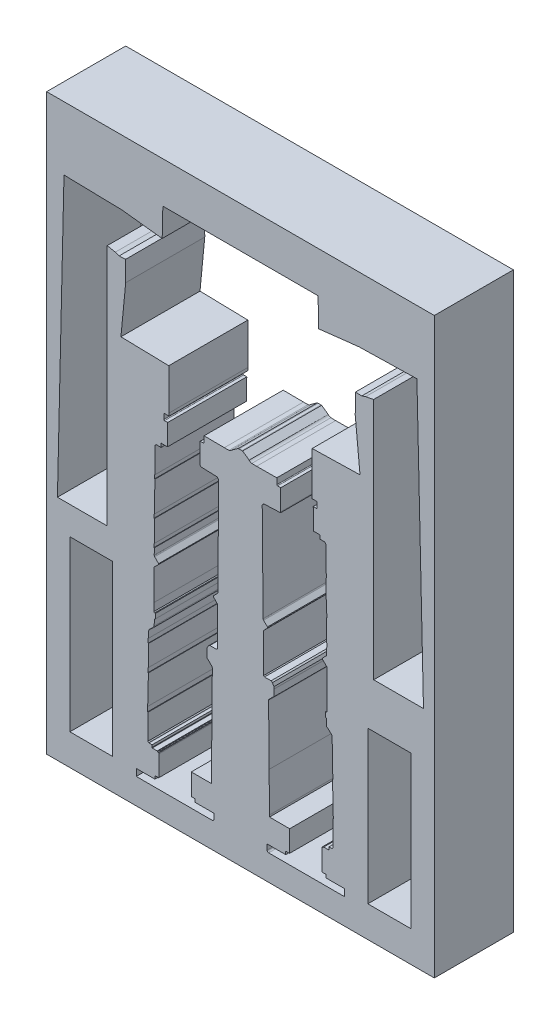
from build123d import *

# Parameters (mm, degrees)
SKETCH1_W           = 250
SKETCH1_H           = 370
BOSS_EXTRUDE1_DEPTH = 51
SKETCH2_W           = 27.335613065
SKETCH2_H           = 108.94321261
SKETCH2_W_2         = 27.852265483
SKETCH2_H_2         = 98.093511825
CUT_EXTRUDE1_DEPTH  = 285.123212709


with BuildPart() as part:
    # Sketch1 → Boss-Extrude1 (new body)
    with BuildSketch(Plane.XY):
        with Locations((0, -65)):
            Rectangle(SKETCH1_W, SKETCH1_H)
        with BuildLine():
            Line((-18.185021614, -233.531351709), (-67.185021808, -233.531351709))
            Line((-67.185021808, -233.531351709), (-67.185021808, -229.031351709))
            Line((-67.185021808, -229.031351709), (-55.173295176, -229.031351709))
            Line((-55.173295176, -229.031351709), (-55.173295176, -227.025013029))
            Line((-55.173295176, -227.025013029), (-52.683469695, -227.025013029))
            Line((-52.683469695, -227.025013029), (-52.685021808, -213.713725897))
            Line((-52.685021808, -213.713725897), (-52.635687886, -213.015646245))
            Line((-52.635687886, -213.015646245), (-53.046121529, -213.015646245))
            Line((-53.046121529, -213.015646245), (-53.442386914, -212.783926548))
            Line((-53.442386914, -212.783926548), (-53.690969911, -212.510759245))
            Line((-53.690969911, -212.510759245), (-56.723904041, -212.494295647))
            Line((-56.723904041, -212.494295647), (-56.956772754, -212.494295647))
            Line((-56.956772754, -212.494295647), (-57.027388135, -212.278767542))
            Line((-57.027388135, -212.278767542), (-57.021200289, -212.191616046))
            Line((-57.021200289, -212.191616046), (-57.008306081, -210.75455377))
            Line((-57.008306081, -210.75455377), (-58.883159083, -210.753940442))
            Line((-58.883159083, -210.753940442), (-59.106546484, -210.706908692))
            Line((-59.106546484, -210.706908692), (-59.678224018, -210.101533972))
            Line((-59.678224018, -210.101533972), (-59.556340753, -193.907794869))
            Line((-59.556340753, -193.907794869), (-59.554955617, -193.753421158))
            Line((-59.554955617, -193.753421158), (-59.854943541, -193.750729482))
            Line((-59.854943541, -193.750729482), (-59.828111994, -190.760347687))
            Line((-59.828111994, -190.760347687), (-59.357762351, -171.776188727))
            Line((-59.357762351, -171.776188727), (-59.657750275, -171.773497051))
            Line((-59.657750275, -171.773497051), (-59.630918728, -168.783115256))
            Line((-59.630918728, -168.783115256), (-59.330930803, -168.785806933))
            Line((-59.330930803, -168.785806933), (-59.209300032, -155.230358554))
            Line((-59.209300032, -155.230358554), (-59.509855326, -155.290572728))
            Line((-59.509855326, -155.290572728), (-59.483023778, -152.300190933))
            Line((-59.483023778, -152.300190933), (-59.183055092, -152.304175917))
            Line((-59.183055092, -152.304175917), (-59.14426295, -147.986426729))
            ThreePointArc((-59.14426295, -147.986426729), (-59.06598535, -147.603401722), (-58.849519734, -147.277858829))
            Line((-58.849519734, -147.277858829), (-56.207336343, -144.671249947))
            ThreePointArc((-56.207336343, -144.671249947), (-55.93294031, -144.472614758), (-55.611659616, -144.365246994))
            Line((-55.611659616, -144.365246994), (-55.605728481, -143.704220728))
            Line((-55.605728481, -143.704220728), (-55.573192383, -140.080460338))
            ThreePointArc((-55.573192383, -140.080460338), (-55.364538546, -139.582349279), (-54.866849153, -139.372691655))
            Line((-54.866849153, -139.372691655), (-54.866849153, -136.323642366))
            Line((-54.866849153, -136.323642366), (-55.389440509, -136.318953354))
            Line((-55.389440509, -136.318953354), (-55.884964754, -135.814457936))
            Line((-55.884964754, -135.814457936), (-55.839789757, -130.772915055))
            Line((-55.839789757, -130.772915055), (-55.660658646, -110.815493364))
            Line((-55.660658646, -110.815493364), (-52.781709227, -107.987743))
            Line((-52.781709227, -107.987743), (-52.781709227, -107.484907855))
            Line((-52.781709227, -107.484907855), (-55.318252521, -104.907581222))
            ThreePointArc((-55.318252521, -104.907581222), (-55.530620104, -104.582967818), (-55.601271237, -104.201546437))
            Line((-55.601271237, -104.201546437), (-55.564115337, -100.059928078))
            Line((-55.564115337, -100.059928078), (-55.864194832, -100.063234391))
            Line((-55.864194832, -100.063234391), (-55.841764195, -97.56333502))
            Line((-55.841764195, -97.56333502), (-55.54177627, -97.566026696))
            Line((-55.54177627, -97.566026696), (-55.416164704, -83.566590217))
            Line((-55.416164704, -83.566590217), (-55.716152628, -83.56389854))
            Line((-55.716152628, -83.56389854), (-55.693721991, -81.063999169))
            Line((-55.693721991, -81.063999169), (-55.393734067, -81.066690846))
            Line((-55.393734067, -81.066690846), (-55.218775098, -61.56747575))
            Line((-55.218775098, -61.56747575), (-55.518763023, -61.564784073))
            Line((-55.518763023, -61.564784073), (-55.496332386, -59.064884702))
            Line((-55.496332386, -59.064884702), (-55.196344461, -59.067576378))
            Line((-55.196344461, -59.067576378), (-55.048969005, -42.642549665))
            ThreePointArc((-55.048969005, -42.642549665), (-55.025101143, -42.527948071), (-54.959191853, -42.43120529))
            Line((-54.959191853, -42.43120529), (-54.279717387, -41.763874475))
            Line((-54.279717387, -41.763874475), (-51.203665072, -41.835346608))
            Line((-51.203665072, -41.835346608), (-51.203665072, -39.38923516))
            Line((-51.203665072, -39.38923516), (-47.045907397, -39.38923516))
            Line((-47.045907397, -39.38923516), (-46.936772239, -25.721501587))
            Line((-46.936772239, -25.721501587), (-48.948683759, -25.721501587))
            ThreePointArc((-48.948683759, -25.721501587), (-49.30223715, -25.575054978), (-49.44868376, -25.221501587))
            Line((-49.44868376, -25.221501587), (-49.448683759, -22.221501587))
            ThreePointArc((-49.448683759, -22.221501587), (-49.30223715, -21.867948197), (-48.94868376, -21.721501587))
            Line((-48.94868376, -21.721501587), (-46.01210545, -21.721501587))
            Line((-46.01210545, -21.721501587), (-45.998168892, -19.921501587))
            Line((-45.998168892, -19.921501587), (-46.233783896, 6.337841933))
            Line((-46.233783896, 6.337841933), (-77.088207762, 7.054745049))
            Line((-77.088207762, 7.054745049), (-74.016505234, 38.807848848))
            Line((-74.016505234, 38.807848848), (-74.120502381, 51.785705827))
            Line((-74.120502381, 51.785705827), (-78.220506343, 51.666031674))
            Line((-78.220506343, 51.666031674), (-80.720506343, 52.506819007))
            Line((-80.720506343, 52.506819007), (-85.910513182, 53.567167336))
            Line((-85.910513182, 53.567167336), (-85.910513182, -103.004374638))
            Line((-85.910513182, -103.004374638), (-118.027325005, -103.004374638))
            Line((-118.027325005, -103.004374638), (-113.796847451, 79.068969216))
            Line((-113.796847451, 79.068969216), (-78.220506343, 78.254616739))
            Line((-78.220506343, 78.254616739), (-76.720506343, 78.254616739))
            Line((-76.720506343, 78.254616739), (-50.470506343, 75.261840244))
            Line((-50.470506343, 75.261840244), (-50.05201383, 93.544381064))
            Line((-50.05201383, 93.544381064), (50.05201383, 93.544381064))
            Line((50.05201383, 93.544381064), (50.470506343, 75.261840244))
            Line((50.470506343, 75.261840244), (76.720506343, 78.254616739))
            Line((76.720506343, 78.254616739), (78.220506343, 78.254616739))
            Line((78.220506343, 78.254616739), (113.796847451, 79.068969216))
            Line((113.796847451, 79.068969216), (118.027325005, -103.004374638))
            Line((118.027325005, -103.004374638), (85.910513182, -103.004374638))
            Line((85.910513182, -103.004374638), (85.910513182, 53.567167336))
            Line((85.910513182, 53.567167336), (80.720506343, 52.506819007))
            Line((80.720506343, 52.506819007), (78.220506343, 51.666031674))
            Line((78.220506343, 51.666031674), (74.120502381, 51.785705827))
            Line((74.120502381, 51.785705827), (74.016505234, 38.807848848))
            Line((74.016505234, 38.807848848), (77.088207762, 7.054745049))
            Line((77.088207762, 7.054745049), (46.233783896, 6.337841933))
            Line((46.233783896, 6.337841933), (45.998168892, -19.921501587))
            Line((45.998168892, -19.921501587), (46.01210545, -21.721501587))
            Line((46.01210545, -21.721501587), (48.94868376, -21.721501587))
            ThreePointArc((48.94868376, -21.721501587), (49.30223715, -21.867948197), (49.448683759, -22.221501587))
            Line((49.448683759, -22.221501587), (49.44868376, -25.221501587))
            ThreePointArc((49.44868376, -25.221501587), (49.30223715, -25.575054978), (48.948683759, -25.721501587))
            Line((48.948683759, -25.721501587), (46.936772239, -25.721501587))
            Line((46.936772239, -25.721501587), (47.045907397, -39.38923516))
            Line((47.045907397, -39.38923516), (51.203665072, -39.38923516))
            Line((51.203665072, -39.38923516), (51.203665072, -41.835346608))
            Line((51.203665072, -41.835346608), (54.279717387, -41.763874475))
            Line((54.279717387, -41.763874475), (54.959191853, -42.43120529))
            ThreePointArc((54.959191853, -42.43120529), (55.025101143, -42.527948071), (55.048969005, -42.642549665))
            Line((55.048969005, -42.642549665), (55.196344461, -59.067576378))
            Line((55.196344461, -59.067576378), (55.496332386, -59.064884702))
            Line((55.496332386, -59.064884702), (55.518763023, -61.564784073))
            Line((55.518763023, -61.564784073), (55.218775098, -61.56747575))
            Line((55.218775098, -61.56747575), (55.393734067, -81.066690846))
            Line((55.393734067, -81.066690846), (55.693721991, -81.063999169))
            Line((55.693721991, -81.063999169), (55.716152628, -83.56389854))
            Line((55.716152628, -83.56389854), (55.416164704, -83.566590217))
            Line((55.416164704, -83.566590217), (55.54177627, -97.566026696))
            Line((55.54177627, -97.566026696), (55.841764195, -97.56333502))
            Line((55.841764195, -97.56333502), (55.864194832, -100.063234391))
            Line((55.864194832, -100.063234391), (55.564115337, -100.059928078))
            Line((55.564115337, -100.059928078), (55.601271237, -104.201546437))
            ThreePointArc((55.601271237, -104.201546437), (55.530620104, -104.582967818), (55.318252521, -104.907581222))
            Line((55.318252521, -104.907581222), (52.781709227, -107.484907855))
            Line((52.781709227, -107.484907855), (52.781709227, -107.987743))
            Line((52.781709227, -107.987743), (55.660658646, -110.815493364))
            Line((55.660658646, -110.815493364), (55.839789757, -130.772915055))
            Line((55.839789757, -130.772915055), (55.884964754, -135.814457936))
            Line((55.884964754, -135.814457936), (55.389440509, -136.318953354))
            Line((55.389440509, -136.318953354), (54.866849153, -136.323642366))
            Line((54.866849153, -136.323642366), (54.866849153, -139.372691655))
            ThreePointArc((54.866849153, -139.372691655), (55.364538546, -139.582349279), (55.573192383, -140.080460338))
            Line((55.573192383, -140.080460338), (55.605728481, -143.704220728))
            Line((55.605728481, -143.704220728), (55.611659616, -144.365246994))
            ThreePointArc((55.611659616, -144.365246994), (55.93294031, -144.472614758), (56.207336343, -144.671249947))
            Line((56.207336343, -144.671249947), (58.849519734, -147.277858829))
            ThreePointArc((58.849519734, -147.277858829), (59.06598535, -147.603401722), (59.14426295, -147.986426729))
            Line((59.14426295, -147.986426729), (59.183055092, -152.304175917))
            Line((59.183055092, -152.304175917), (59.483023778, -152.300190933))
            Line((59.483023778, -152.300190933), (59.509855326, -155.290572728))
            Line((59.509855326, -155.290572728), (59.209300032, -155.230358554))
            Line((59.209300032, -155.230358554), (59.330930803, -168.785806933))
            Line((59.330930803, -168.785806933), (59.630918728, -168.783115256))
            Line((59.630918728, -168.783115256), (59.657750275, -171.773497051))
            Line((59.657750275, -171.773497051), (59.357762351, -171.776188727))
            Line((59.357762351, -171.776188727), (59.828111994, -190.760347687))
            Line((59.828111994, -190.760347687), (59.854943541, -193.750729482))
            Line((59.854943541, -193.750729482), (59.554955617, -193.753421158))
            Line((59.554955617, -193.753421158), (59.556340753, -193.907794869))
            Line((59.556340753, -193.907794869), (59.678224018, -210.101533972))
            Line((59.678224018, -210.101533972), (59.106546484, -210.706908692))
            Line((59.106546484, -210.706908692), (58.883159083, -210.753940442))
            Line((58.883159083, -210.753940442), (57.008306081, -210.75455377))
            Line((57.008306081, -210.75455377), (57.021200289, -212.191616046))
            Line((57.021200289, -212.191616046), (57.027388135, -212.278767542))
            Line((57.027388135, -212.278767542), (56.956772754, -212.494295647))
            Line((56.956772754, -212.494295647), (56.723904041, -212.494295647))
            Line((56.723904041, -212.494295647), (53.690969911, -212.510759245))
            Line((53.690969911, -212.510759245), (53.442386914, -212.783926548))
            Line((53.442386914, -212.783926548), (53.046121529, -213.015646245))
            Line((53.046121529, -213.015646245), (52.635687886, -213.015646245))
            Line((52.635687886, -213.015646245), (52.685021808, -213.713725897))
            Line((52.685021808, -213.713725897), (52.683469695, -227.025013029))
            Line((52.683469695, -227.025013029), (55.173295176, -227.025013029))
            Line((55.173295176, -227.025013029), (55.173295176, -229.031351709))
            Line((55.173295176, -229.031351709), (67.185021808, -229.031351709))
            Line((67.185021808, -229.031351709), (67.185021808, -233.531351709))
            Line((67.185021808, -233.531351709), (18.185021614, -233.531351709))
            ThreePointArc((18.185021614, -233.531351709), (17.477914901, -233.238458478), (17.185021808, -232.531351709))
            Line((17.185021808, -232.531351709), (17.185021808, -229.031351709))
            Line((17.185021808, -229.031351709), (29.185021808, -229.031351709))
            Line((29.185021808, -229.031351709), (29.185021808, -227.531351709))
            ThreePointArc((29.185021808, -227.531351709), (29.331468418, -227.177798318), (29.685021808, -227.031351709))
            Line((29.685021808, -227.031351709), (31.696933329, -227.031351709))
            Line((31.696933329, -227.031351709), (31.728920327, -213.267440099))
            Line((31.728920327, -213.267440099), (27.406582755, -213.267440099))
            Line((27.406582755, -213.267440099), (18.717794744, -213.267440099))
            Line((18.717794744, -213.267440099), (18.717794744, -212.084118939))
            Line((18.717794744, -212.084118939), (18.490494489, -186.753149347))
            Line((18.490494489, -186.753149347), (18.146119113, -148.3676652))
            ThreePointArc((18.146119113, -148.3676652), (18.218690757, -147.980418571), (18.432528056, -147.649510421))
            Line((18.432528056, -147.649510421), (21.038681653, -144.961279731))
            Line((21.038681653, -144.961279731), (21.612392658, -144.597916255))
            Line((21.612392658, -144.597916255), (21.574667918, -140.393485729))
            Line((21.574667918, -140.393485729), (21.575743958, -138.995013616))
            Line((21.575743958, -138.995013616), (20.60396081, -137.264039157))
            Line((20.60396081, -137.264039157), (19.735604854, -136.638861528))
            Line((19.735604854, -136.638861528), (15.449808778, -136.677316331))
            Line((15.449808778, -136.677316331), (14.886615065, -136.182320382))
            Line((14.886615065, -136.182320382), (14.700509107, -111.198778754))
            Line((14.700509107, -111.198778754), (17.49014468, -108.304314471))
            Line((17.49014468, -108.304314471), (17.426090213, -107.731396164))
            Line((17.426090213, -107.731396164), (14.898787748, -105.270389354))
            ThreePointArc((14.898787748, -105.270389354), (14.679958778, -104.949831488), (14.603007376, -104.569408111))
            Line((14.603007376, -104.569408111), (14.03489787, -41.256826553))
            Line((14.03489787, -41.256826553), (15.025222608, -40.177241554))
            Line((15.025222608, -40.177241554), (25.87180615, -39.745978055))
            Line((25.87180615, -39.745978055), (25.948683759, -39.221501588))
            Line((25.948683759, -39.221501588), (25.960595281, -25.721501587))
            Line((25.960595281, -25.721501587), (23.94868376, -25.721501587))
            ThreePointArc((23.94868376, -25.721501587), (23.595130369, -25.575054978), (23.448683759, -25.221501587))
            Line((23.448683759, -25.221501587), (23.448683759, -21.417500478))
            Line((23.448683759, -21.417500478), (10.381902963, -21.521489456))
            ThreePointArc((10.381902963, -21.521489456), (8.858158094, -21.501545551), (7.33660211, -21.417500478))
            ThreePointArc((7.33660211, -21.417500478), (6.368428078, -21.126798616), (5.610200328, -20.458248537))
            Line((5.610200328, -20.458248537), (1.375684549, -17.463325165))
            Line((1.375684549, -17.463325165), (0.862741647, -17.494150137))
            Line((0.862741647, -17.494150137), (-0.862741647, -17.494150137))
            Line((-0.862741647, -17.494150137), (-1.375684549, -17.463325165))
            Line((-1.375684549, -17.463325165), (-5.610200328, -20.458248537))
            ThreePointArc((-5.610200328, -20.458248537), (-6.368428078, -21.126798616), (-7.33660211, -21.417500478))
            ThreePointArc((-7.33660211, -21.417500478), (-8.858158094, -21.501545551), (-10.381902963, -21.521489456))
            Line((-10.381902963, -21.521489456), (-23.448683759, -21.417500478))
            Line((-23.448683759, -21.417500478), (-23.448683759, -25.221501587))
            ThreePointArc((-23.448683759, -25.221501587), (-23.595130369, -25.575054978), (-23.94868376, -25.721501587))
            Line((-23.94868376, -25.721501587), (-25.960595281, -25.721501587))
            Line((-25.960595281, -25.721501587), (-25.948683759, -39.221501588))
            Line((-25.948683759, -39.221501588), (-25.87180615, -39.745978055))
            Line((-25.87180615, -39.745978055), (-15.025222608, -40.177241554))
            Line((-15.025222608, -40.177241554), (-14.03489787, -41.256826553))
            Line((-14.03489787, -41.256826553), (-14.603007376, -104.569408111))
            ThreePointArc((-14.603007376, -104.569408111), (-14.679958778, -104.949831488), (-14.898787748, -105.270389354))
            Line((-14.898787748, -105.270389354), (-17.426090213, -107.731396164))
            Line((-17.426090213, -107.731396164), (-17.49014468, -108.304314471))
            Line((-17.49014468, -108.304314471), (-14.700509107, -111.198778754))
            Line((-14.700509107, -111.198778754), (-14.886615065, -136.182320382))
            Line((-14.886615065, -136.182320382), (-15.449808778, -136.677316331))
            Line((-15.449808778, -136.677316331), (-19.735604854, -136.638861528))
            Line((-19.735604854, -136.638861528), (-20.60396081, -137.264039157))
            Line((-20.60396081, -137.264039157), (-21.575743958, -138.995013616))
            Line((-21.575743958, -138.995013616), (-21.574667918, -140.393485729))
            Line((-21.574667918, -140.393485729), (-21.612392658, -144.597916255))
            Line((-21.612392658, -144.597916255), (-21.038681653, -144.961279731))
            Line((-21.038681653, -144.961279731), (-18.432528056, -147.649510421))
            ThreePointArc((-18.432528056, -147.649510421), (-18.218690757, -147.980418571), (-18.146119113, -148.3676652))
            Line((-18.146119113, -148.3676652), (-18.490494489, -186.753149347))
            Line((-18.490494489, -186.753149347), (-18.717794744, -212.084118939))
            Line((-18.717794744, -212.084118939), (-18.717794744, -213.267440099))
            Line((-18.717794744, -213.267440099), (-27.406582755, -213.267440099))
            Line((-27.406582755, -213.267440099), (-31.728920327, -213.267440099))
            Line((-31.728920327, -213.267440099), (-31.696933329, -227.031351709))
            Line((-31.696933329, -227.031351709), (-29.685021808, -227.031351709))
            ThreePointArc((-29.685021808, -227.031351709), (-29.331468418, -227.177798318), (-29.185021808, -227.531351709))
            Line((-29.185021808, -227.531351709), (-29.185021808, -229.031351709))
            Line((-29.185021808, -229.031351709), (-17.185021808, -229.031351709))
            Line((-17.185021808, -229.031351709), (-17.185021808, -232.531351709))
            ThreePointArc((-17.185021808, -232.531351709), (-17.477914901, -233.238458478), (-18.185021614, -233.531351709))
        make_face(mode=Mode.SUBTRACT)
    extrude(amount=BOSS_EXTRUDE1_DEPTH)

    # Sketch2 → Cut-Extrude1 (cut, through all)
    with BuildSketch(Plane.XY.offset(51)):
        with Locations((-96.332193468, -175.528393695)):
            Rectangle(SKETCH2_W, SKETCH2_H)
        with Locations((96.073867259, -180.953244088)):
            Rectangle(SKETCH2_W_2, SKETCH2_H_2)
    extrude(amount=-CUT_EXTRUDE1_DEPTH, mode=Mode.SUBTRACT)


solid = part.part
